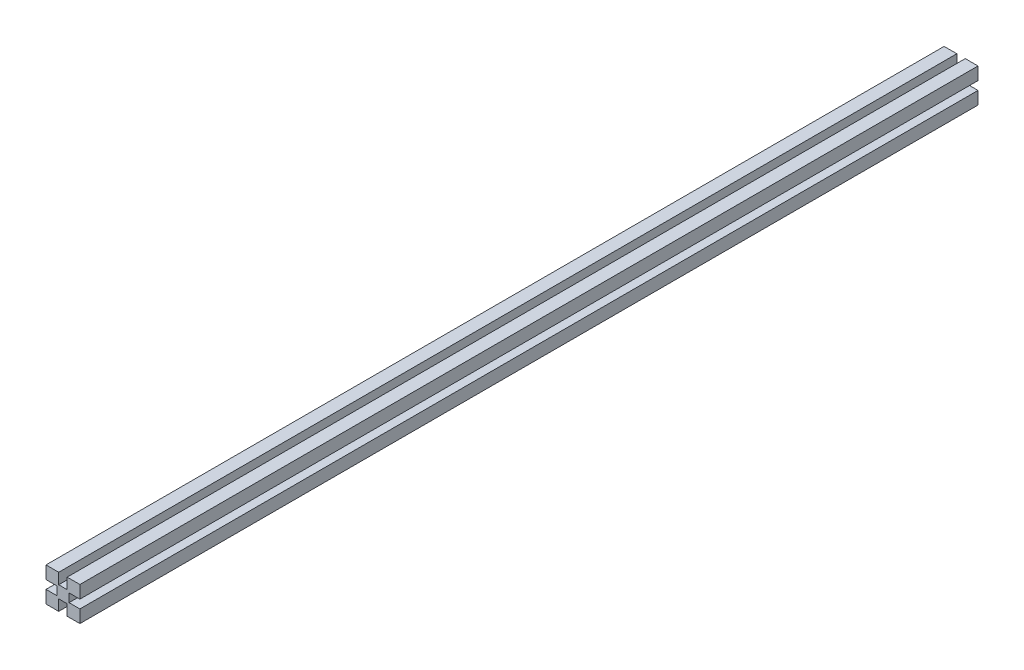
from build123d import *

# Parameters (mm, degrees)
BOSS_EXTRUDE1_DEPTH = 673.1


with BuildPart() as part:
    # Sketch1 → Boss-Extrude1 (new body)
    with BuildSketch(Plane.XY):
        Polygon((-12.7, 12.7), (-12.7, 3.175), (-4.572, 3.175), (-4.572, -3.175), (-12.7, -3.175), (-12.7, -12.7), (-3.175, -12.7), (-3.175, -4.572), (3.175, -4.572), (3.175, -12.7), (12.7, -12.7), (12.7, -3.175), (4.572, -3.175), (4.572, 3.175), (12.7, 3.175), (12.7, 12.7), (3.175, 12.7), (3.175, 4.572), (-3.175, 4.572), (-3.175, 12.7), align=None)
    extrude(amount=BOSS_EXTRUDE1_DEPTH)


solid = part.part
